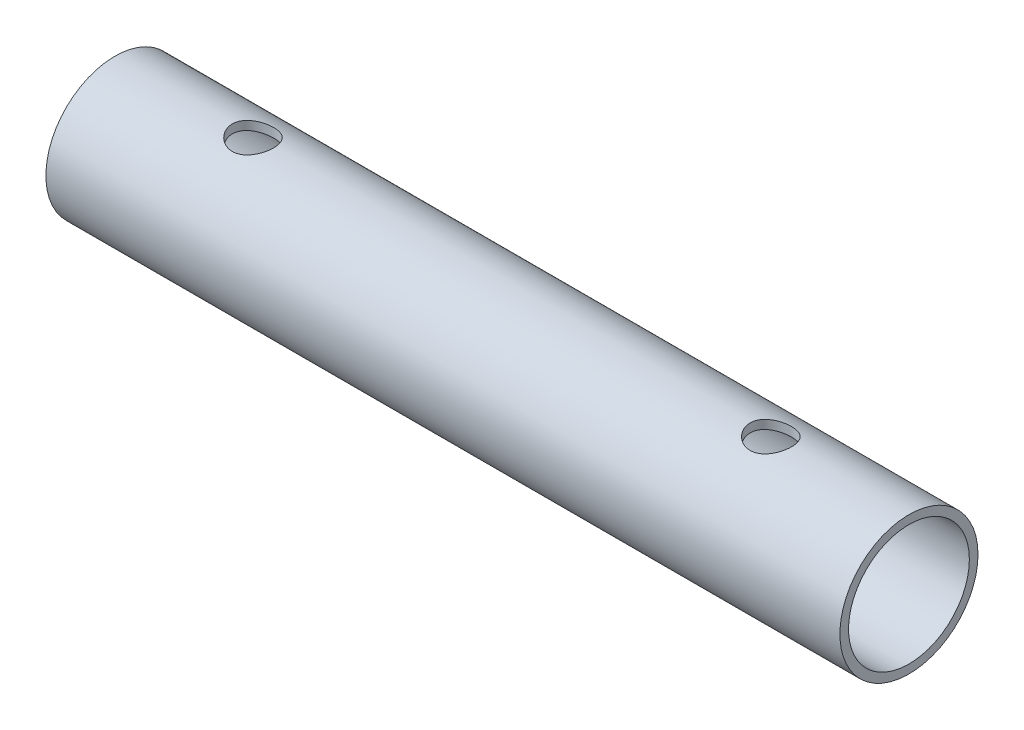
from build123d import *

# Parameters (mm, degrees)
SKETCH_1_R               = 10
SKETCH_1_R_2             = 8.75
EXTRUDE_1_DEPTH          = 115
CUT_EXTRUDE_1_DEPTH      = 116.866302263
CUT_EXTRUDE_1_DEPTH_BACK = 116.866302263
SKETCH_2_R               = 3


with BuildPart() as part:
    # 草图1 → 凸台-拉伸1 (new body)
    with BuildSketch(Plane(origin=(0, 0, 0), x_dir=(0, 0, -1), z_dir=(1, 0, 0))):
        Circle(SKETCH_1_R)
        Circle(SKETCH_1_R_2, mode=Mode.SUBTRACT)
    extrude(amount=EXTRUDE_1_DEPTH)

    # 草图2 → 切除-拉伸1 (cut, two sides: drawn at the far end of the back side and taken through both)
    with BuildSketch(Plane(origin=(0, 0, 0), x_dir=(1, 0, 0), z_dir=(0, 1, 0)).offset(-CUT_EXTRUDE_1_DEPTH_BACK)):
        with Locations(Location((20, 0, 0), (0, 0, 270))):
            Circle(SKETCH_2_R)
        with Locations(Location((95, 0, 0), (0, 0, 270))):
            Circle(SKETCH_2_R)
    extrude(amount=CUT_EXTRUDE_1_DEPTH + CUT_EXTRUDE_1_DEPTH_BACK, mode=Mode.SUBTRACT)


solid = part.part
